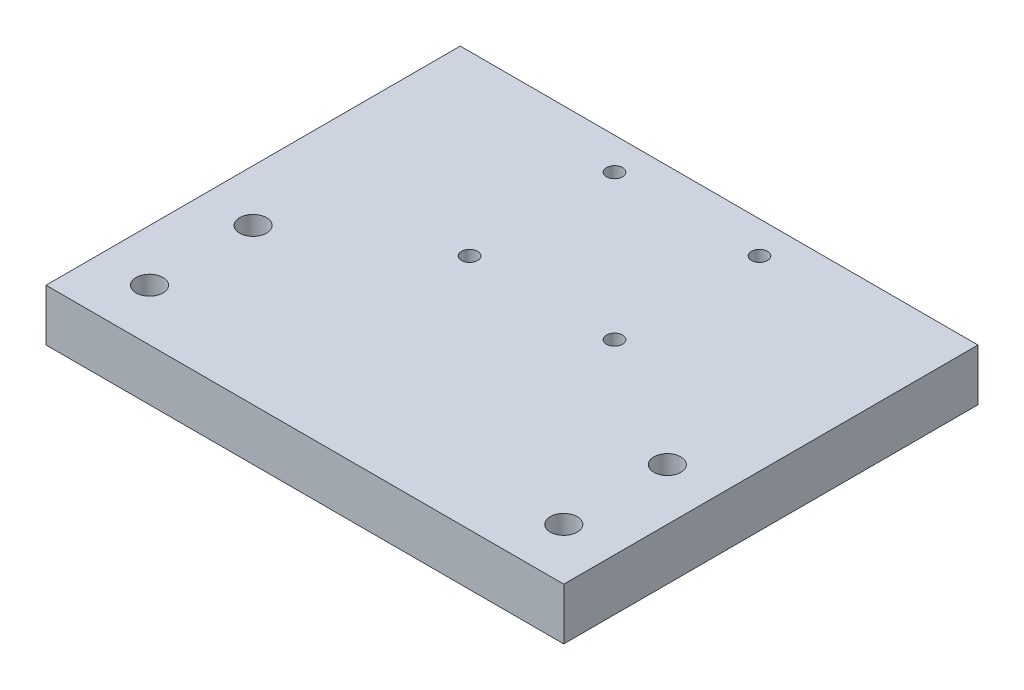
from build123d import *

# Parameters (mm, degrees)
SKETCH_1_W          = 100
SKETCH_1_H          = 80
EXTRUDE_1_DEPTH     = 10
SKETCH_3_R          = 2.6
CUT_EXTRUDE_2_DEPTH = 65.807406984
SKETCH_4_R          = 1.55
CUT_EXTRUDE_3_DEPTH = 65.807406984


with BuildPart() as part:
    # 草图1 → 凸台-拉伸1 (new body)
    with BuildSketch(Plane(origin=(0, 0, 0), x_dir=(1, 0, 0), z_dir=(0, 1, 0))):
        Rectangle(SKETCH_1_W, SKETCH_1_H)
    extrude(amount=EXTRUDE_1_DEPTH)

    # 草图3 → 切除-拉伸2 (cut, through all)
    with BuildSketch(Plane.XZ):
        with Locations(Location((40, 30, 0), (0, 0, 270))):
            Circle(SKETCH_3_R)
        with Locations(Location((40, 10, 0), (0, 0, 270))):
            Circle(SKETCH_3_R)
        with Locations(Location((-40, 30, 0), (0, 0, 270))):
            Circle(SKETCH_3_R)
        with Locations(Location((-40, 10, 0), (0, 0, 270))):
            Circle(SKETCH_3_R)
    extrude(amount=-CUT_EXTRUDE_2_DEPTH, mode=Mode.SUBTRACT)

    # 草图4 → 切除-拉伸3 (cut, through all)
    with BuildSketch(Plane(origin=(0, 10, 0), x_dir=(1, 0, 0), z_dir=(0, 1, 0))):
        with Locations(Location((14, 33.8, 0), (0, 0, 270))):
            Circle(SKETCH_4_R)
        with Locations(Location((14, 5.8, 0), (0, 0, 270))):
            Circle(SKETCH_4_R)
        with Locations(Location((-14, 33.8, 0), (0, 0, 270))):
            Circle(SKETCH_4_R)
        with Locations(Location((-14, 5.8, 0), (0, 0, 270))):
            Circle(SKETCH_4_R)
    extrude(amount=-CUT_EXTRUDE_3_DEPTH, mode=Mode.SUBTRACT)


solid = part.part
